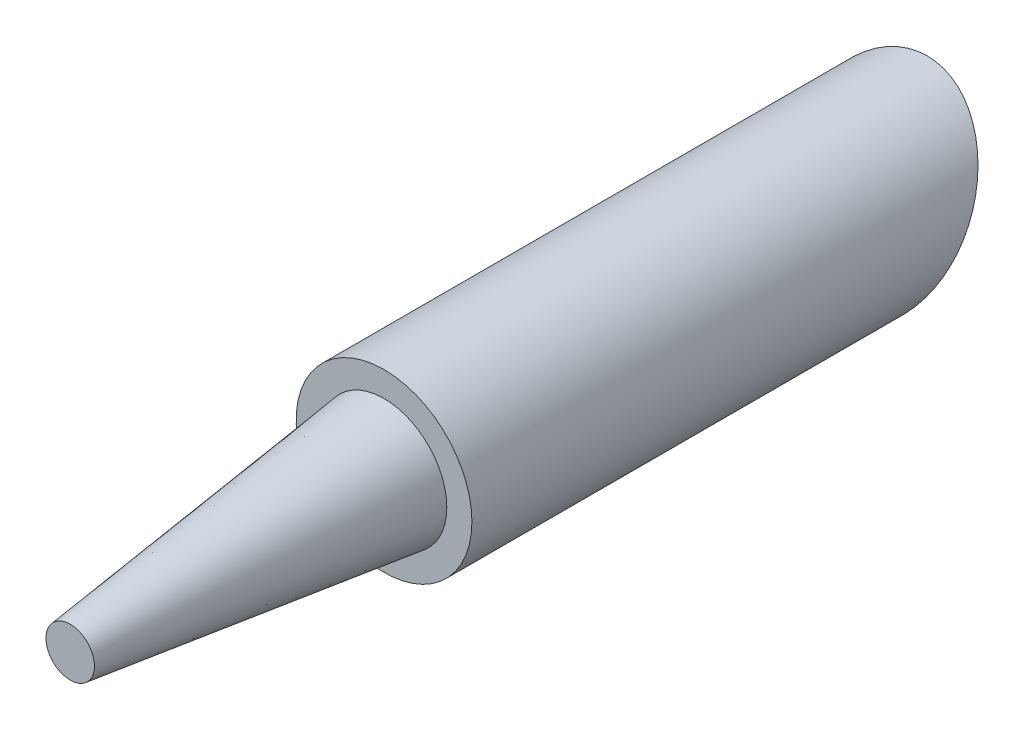
from build123d import *

# Parameters (mm, degrees)
SKETCH1_R               = 17.78
BOSS_EXTRUDE1_DEPTH     = 111.76
SKETCH2_R               = 12.7
BOSS_EXTRUDE2_DEPTH     = 63.5
BOSS_EXTRUDE2_TAPER     = 7
CUT_EXTRUDE1_DEPTH      = 178.054580285
CUT_EXTRUDE1_DEPTH_BACK = 178.054580285


with BuildPart() as part:
    # Sketch1 → Boss-Extrude1 (new body)
    with BuildSketch(Plane.XY):
        Circle(SKETCH1_R)
    extrude(amount=BOSS_EXTRUDE1_DEPTH)

    # Sketch2 → Boss-Extrude2 (add)
    with BuildSketch(Plane.XY.offset(111.76)):
        Circle(SKETCH2_R)
    extrude(amount=BOSS_EXTRUDE2_DEPTH, taper=BOSS_EXTRUDE2_TAPER)

    # Sketch4 → Cut-Extrude1 (cut, two sides: drawn at the far end of the back side and taken through both)
    with BuildSketch(Plane(origin=(0, 0, 0), x_dir=(0, 0, -1), z_dir=(1, 0, 0)).offset(-CUT_EXTRUDE1_DEPTH_BACK)):
        Polygon((16.51, 49.579194367), (-26.426841821, -24.789597184), (59.446841821, -24.789597184), align=None)
    extrude(amount=CUT_EXTRUDE1_DEPTH + CUT_EXTRUDE1_DEPTH_BACK, mode=Mode.SUBTRACT)


solid = part.part
